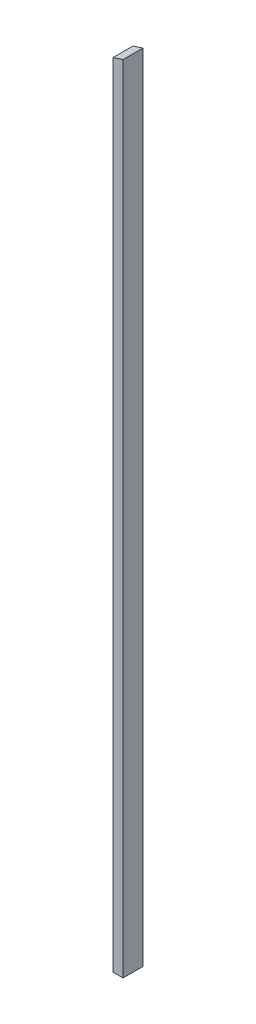
from build123d import *

# Parameters (mm, degrees)
SKETCH_1_W          = 25
SKETCH_1_H          = 50
EXTRUDE_1_DEPTH     = 2000
CUT_EXTRUDE_1_DEPTH = 50


with BuildPart() as part:
    # Эскиз1 → Бобышка-Вытянуть1 (new body)
    with BuildSketch(Plane(origin=(0, 0, 0), x_dir=(1, 0, 0), z_dir=(0, 1, 0))):
        Rectangle(SKETCH_1_W, SKETCH_1_H)
    extrude(amount=EXTRUDE_1_DEPTH)

    # Эскиз2 → Вырез-Вытянуть1 (cut)
    with BuildSketch(Plane.XY.offset(25)):
        Polygon((-12.5, 2000), (-12.5, 1992.06), (12.5, 2000), align=None)
    extrude(amount=-CUT_EXTRUDE_1_DEPTH, mode=Mode.SUBTRACT)


solid = part.part
